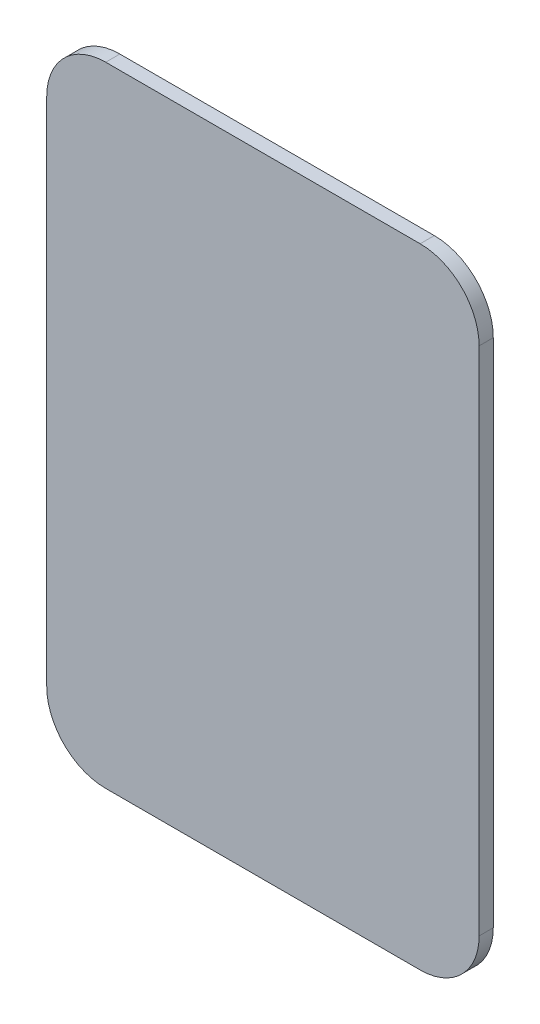
from build123d import *

# Parameters (mm, degrees)
BOSS_EXTRUDE1_DEPTH = 18.288


with BuildPart() as part:
    # Model → Boss-Extrude1 (new body)
    with BuildSketch(Plane.XY):
        with BuildLine():
            Line((177.8, 812.8), (584.2, 812.8))
            ThreePointArc((584.2, 812.8), (638.081536726, 835.118463274), (660.4, 889))
            Line((660.4, 889), (660.4, 1549.4))
            ThreePointArc((660.4, 1549.4), (638.081536726, 1603.281536726), (584.2, 1625.6))
            Line((584.2, 1625.6), (177.8, 1625.6))
            ThreePointArc((177.8, 1625.6), (123.918463274, 1603.281536726), (101.6, 1549.4))
            Line((101.6, 1549.4), (101.6, 889))
            ThreePointArc((101.6, 889), (123.918463274, 835.118463274), (177.8, 812.8))
        make_face()
    extrude(amount=BOSS_EXTRUDE1_DEPTH)


solid = part.part
